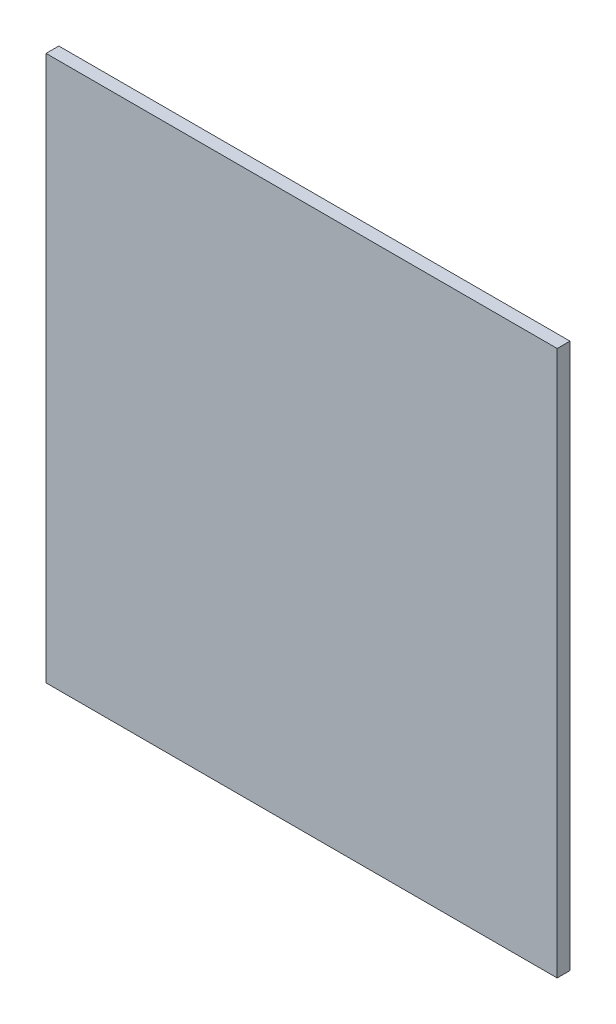
from build123d import *

# Parameters (mm, degrees)
CROQUIS1_W              = 400
CROQUIS1_H              = 426.64
SALIENTE_EXTRUIR1_DEPTH = 10
SALIENTE_EXTRUIR2_DEPTH = 10


with BuildPart() as part:
    # Croquis1 → Saliente-Extruir1 (new body)
    with BuildSketch(Plane.XY):
        Rectangle(CROQUIS1_W, CROQUIS1_H)
    extrude(amount=SALIENTE_EXTRUIR1_DEPTH)

    # Croquis2 → Saliente-Extruir2 (add)
    with BuildSketch(Plane(origin=(0, 0, 0), x_dir=(-1, 0, 0), z_dir=(0, 0, -1))):
        Polygon((-170, 170.618294078), (-159, 176.969147039), (-159, 189.670852961), (-170, 196.021705922), (-181, 189.670852961), (-181, 176.969147039), align=None)
        Polygon((-170, -170.618294078), (-181, -176.969147039), (-181, -189.670852961), (-170, -196.021705922), (-159, -189.670852961), (-159, -176.969147039), align=None)
        Polygon((170, 170.618294078), (181, 176.969147039), (181, 189.670852961), (170, 196.021705922), (159, 189.670852961), (159, 176.969147039), align=None)
        Polygon((170, -170.618294078), (159, -176.969147039), (159, -189.670852961), (170, -196.021705922), (181, -189.670852961), (181, -176.969147039), align=None)
    extrude(amount=SALIENTE_EXTRUIR2_DEPTH)


solid = part.part
